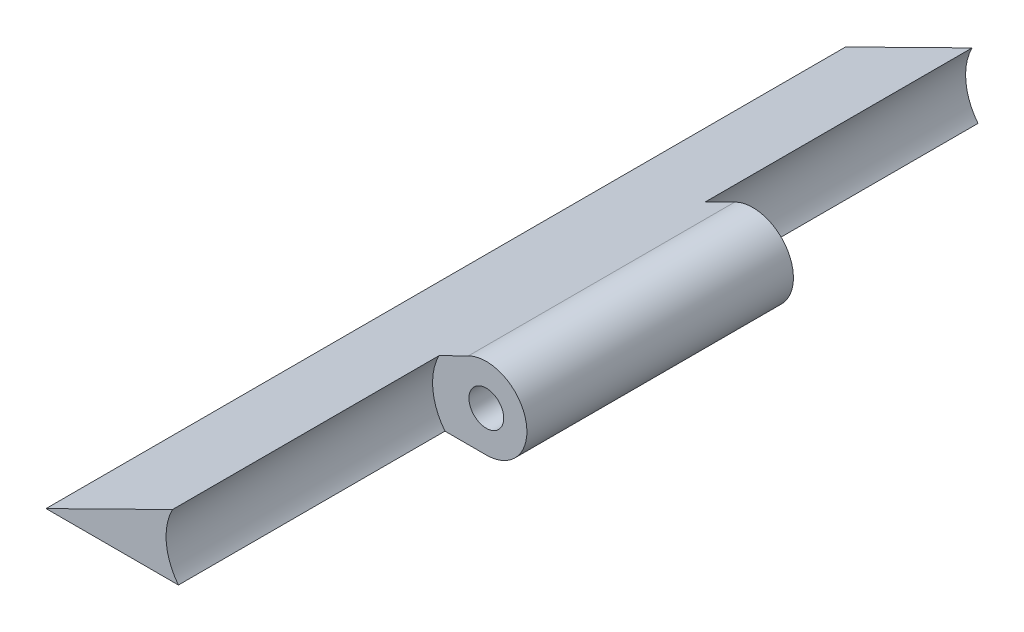
from build123d import *

# Parameters (mm, degrees)
SKETCH1_R           = 3.5
SKETCH1_R_2         = 1.5
BOSS_EXTRUDE1_DEPTH = 11.5
BOSS_EXTRUDE2_DEPTH = 11.5
BOSS_EXTRUDE3_DEPTH = 34.5


with BuildPart() as part:
    # Sketch1 → Boss-Extrude1 (new, symmetric)
    with BuildSketch(Plane.XY):
        Circle(SKETCH1_R)
        Circle(SKETCH1_R_2, mode=Mode.SUBTRACT)
    extrude(amount=BOSS_EXTRUDE1_DEPTH, both=True)

    # Sketch2 → Boss-Extrude2 (add, symmetric)
    with BuildSketch(Plane.XY):
        with BuildLine():
            Line((0, -3.5), (-15, -3.5))
            Line((-15, -3.5), (-1.548998946, 3.138566913))
            ThreePointArc((-1.548998946, 3.138566913), (-3.408444234, -0.795303655), (0, -3.5))
        make_face()
    extrude(amount=BOSS_EXTRUDE2_DEPTH, both=True)

    # Sketch3 → Boss-Extrude3 (add, symmetric)
    with BuildSketch(Plane(origin=(0, 0, 0), x_dir=(-1, 0, 0), z_dir=(0, 0, -1))):
        with BuildLine():
            Line((3.570714214, -3.5), (15, -3.5))
            Line((15, -3.5), (4.081424237, 1.888721293))
            ThreePointArc((4.081424237, 1.888721293), (4.618328991, -0.880724885), (3.570714214, -3.5))
        make_face()
    extrude(amount=BOSS_EXTRUDE3_DEPTH, both=True)


solid = part.part
